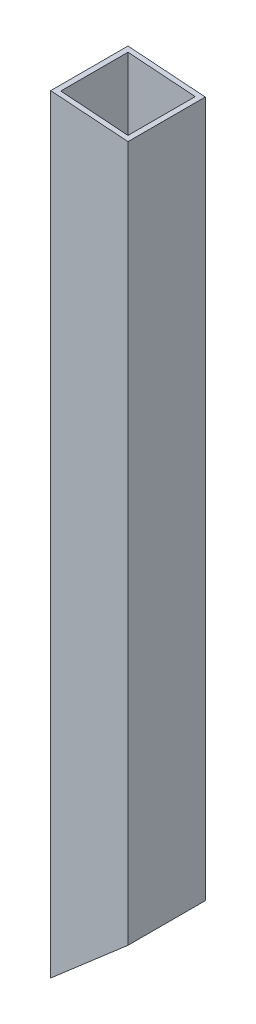
from build123d import *

# Parameters (mm, degrees)
SKETCH4_W           = 25.4
SKETCH4_H           = 25.4
BOSS_EXTRUDE1_DEPTH = 252.579
CUT_EXTRUDE1_DEPTH  = 256.120503372
CUT_EXTRUDE2_DEPTH  = 256.120503372
SHELL1_T            = -1.651


with BuildPart() as part:
    # Sketch4 → Boss-Extrude1 (new body)
    with BuildSketch(Plane(origin=(0, 0, 0), x_dir=(1, 0, 0), z_dir=(0, 1, 0))):
        with Locations((12.7, 12.7)):
            Rectangle(SKETCH4_W, SKETCH4_H)
    extrude(amount=BOSS_EXTRUDE1_DEPTH)

    # Sketch5 → Cut-Extrude1 (cut, through all)
    with BuildSketch(Plane.XY):
        Polygon((0, 252.579), (25.4, 252.579), (25.4, 250.759583461), align=None)
    extrude(amount=-CUT_EXTRUDE1_DEPTH, mode=Mode.SUBTRACT)

    # Sketch6 → Cut-Extrude2 (cut, through all)
    with BuildSketch(Plane.XY):
        Polygon((0, 0), (25.4, 22.004395982), (25.4, 0), align=None)
    extrude(amount=-CUT_EXTRUDE2_DEPTH, mode=Mode.SUBTRACT)

    # Shell1
    shell1_openings = [part.faces().sort_by_distance(p)[0] for p in [
        (12.7, 251.669291731, -12.7),
        (12.7, 11.002197991, -12.7),
    ]]
    offset(amount=SHELL1_T, openings=shell1_openings, kind=Kind.INTERSECTION)


solid = part.part
